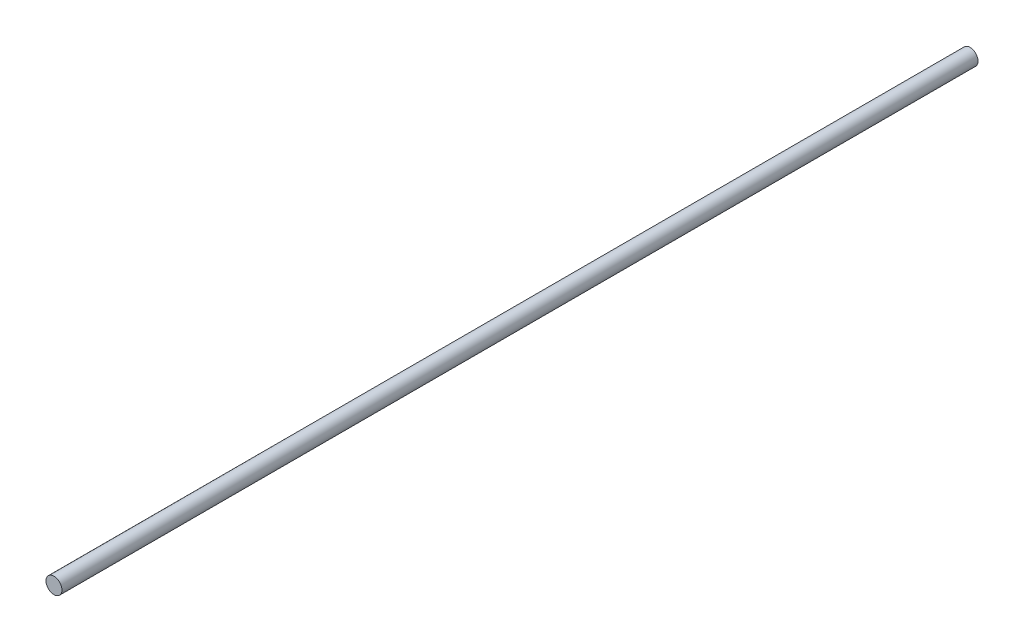
from build123d import *

# Parameters (mm, degrees)
SKETCH1_R           = 5
BOSS_EXTRUDE1_DEPTH = 574


with BuildPart() as part:
    # Sketch1 → Boss-Extrude1 (new body)
    with BuildSketch(Plane.XY):
        Circle(SKETCH1_R)
    extrude(amount=BOSS_EXTRUDE1_DEPTH)


solid = part.part
